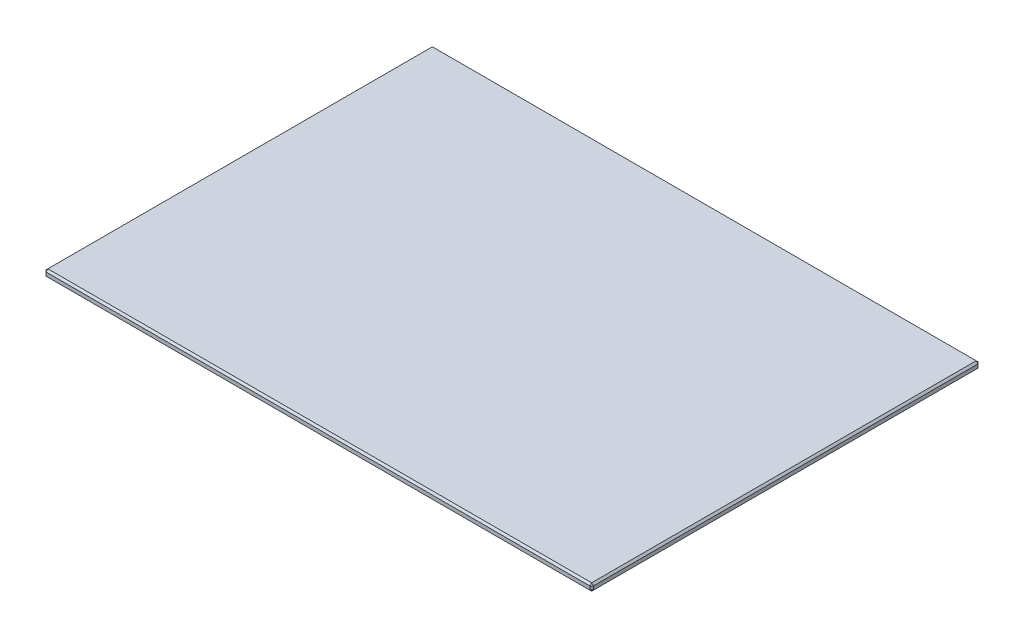
from build123d import *

# Parameters (mm, degrees)
CROQUIS1_W              = 299
CROQUIS1_H              = 212
SALIENTE_EXTRUIR1_DEPTH = 4
CHAFL_N1_SIZE           = 1


with BuildPart() as part:
    # Croquis1 → Saliente-Extruir1 (new body)
    with BuildSketch(Plane(origin=(0, 0, 0), x_dir=(1, 0, 0), z_dir=(0, 1, 0))):
        Rectangle(CROQUIS1_W, CROQUIS1_H)
    extrude(amount=SALIENTE_EXTRUIR1_DEPTH)

    # Chaflán1
    chafl_n1_edges = [part.edges().sort_by_distance(p)[0] for p in [
        (149.5, 4, 0),
        (0, 4, -106),
        (-149.5, 4, 0),
        (0, 0, -106),
        (149.5, 0, 0),
        (0, 0, 106),
        (-149.5, 0, 0),
        (0, 4, 106),
        (-149.5, 2, -106),
        (149.5, 2, -106),
        (149.5, 2, 106),
        (-149.5, 2, 106),
    ]]
    chamfer(chafl_n1_edges, length=CHAFL_N1_SIZE)


solid = part.part
